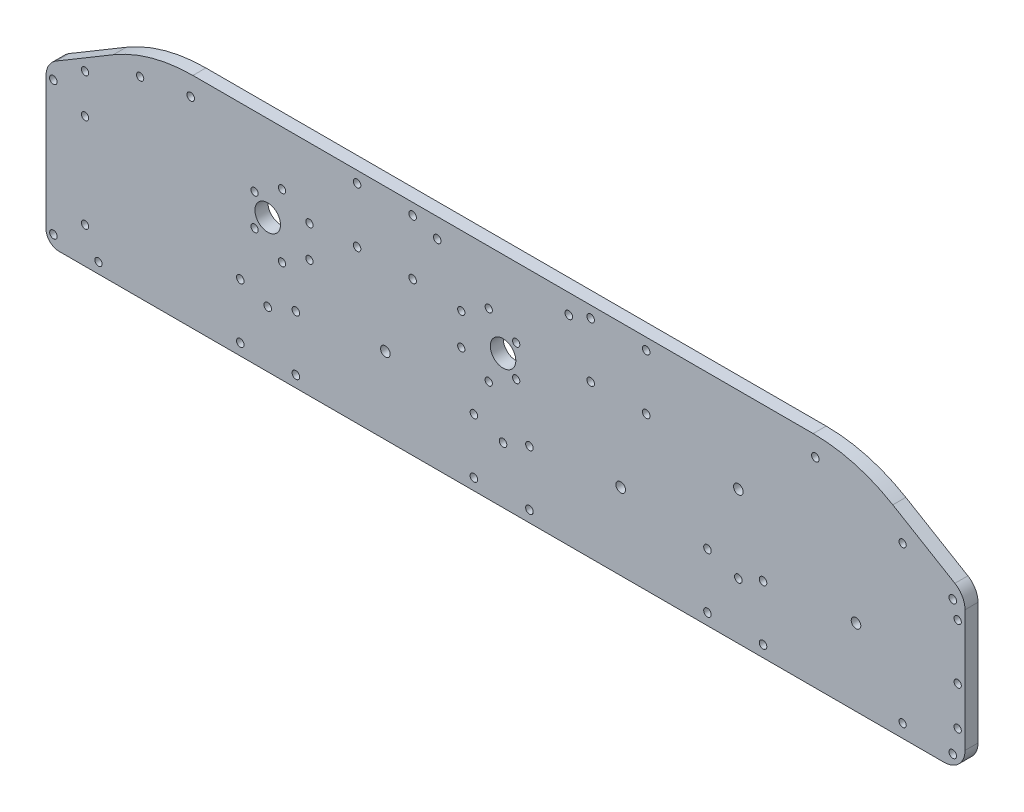
from build123d import *

# Parameters (mm, degrees)
SKETCH1_R           = 2.35
SKETCH1_R_2         = 6.25
SKETCH1_R_3         = 2.349999999
SKETCH1_R_4         = 1.778
SKETCH1_R_5         = 1.85000011
SKETCH1_R_6         = 1.85
BOSS_EXTRUDE3_DEPTH = 6.35


with BuildPart() as part:
    # Sketch1 → Boss-Extrude3 (new body)
    with BuildSketch(Plane.XY):
        with BuildLine():
            Line((226.06, 0), (226.06, -27.287756374))
            ThreePointArc((226.06, -27.287756374), (223.084204897, -34.471961271), (215.9, -37.447756374))
            Line((215.9, -37.447756374), (-215.9, -37.447756374))
            Line((-215.9, -37.447756374), (-217.287383527, -37.447756374))
            ThreePointArc((-217.287383527, -37.447756374), (-221.777511587, -35.587884434), (-223.637383527, -31.097756374))
            Line((-223.637383527, -31.097756374), (-223.637383527, 33.765977424))
            ThreePointArc((-223.637383527, 33.765977424), (-222.309818874, 38.787300541), (-218.674059542, 42.49639313))
            Line((-218.674059542, 42.49639313), (-190.732762109, 59.128117792))
            ThreePointArc((-190.732762109, 59.128117792), (-171.969166759, 67.120649159), (-151.757691995, 69.85))
            Line((-151.757691995, 69.85), (151.757691995, 69.85))
            ThreePointArc((151.757691995, 69.85), (171.969166759, 67.120649159), (190.732762109, 59.128117792))
            Line((190.732762109, 59.128117792), (221.096676015, 41.054359515))
            ThreePointArc((221.096676015, 41.054359515), (224.732435347, 37.345266926), (226.06, 32.323943809))
            Line((226.06, 32.323943809), (226.06, 0))
        make_face()
        with Locations((-57.57418, 0)):
            Circle(SKETCH1_R, mode=Mode.SUBTRACT)
        with Locations((57.5724782, 0)):
            Circle(SKETCH1_R, mode=Mode.SUBTRACT)
        with Locations((172.72, 0)):
            Circle(SKETCH1_R, mode=Mode.SUBTRACT)
        with Locations((-115.14709, 27.952818)):
            Circle(SKETCH1_R_2, mode=Mode.SUBTRACT)
        with Locations((-0.0008509, 27.951954786)):
            Circle(SKETCH1_R_2, mode=Mode.SUBTRACT)
        with Locations((115.1462391, 27.951065379)):
            Circle(SKETCH1_R_3, mode=Mode.SUBTRACT)
        with Locations((-108.14709, 43.452818)):
            Circle(SKETCH1_R_4, mode=Mode.SUBTRACT)
        with Locations((-94.723696241, 35.702818)):
            Circle(SKETCH1_R_4, mode=Mode.SUBTRACT)
        with Locations((-94.723696241, 20.202818)):
            Circle(SKETCH1_R_4, mode=Mode.SUBTRACT)
        with Locations((-108.14709, 12.452818)):
            Circle(SKETCH1_R_4, mode=Mode.SUBTRACT)
        with Locations((-121.570483759, 20.202818)):
            Circle(SKETCH1_R_4, mode=Mode.SUBTRACT)
        with Locations((-121.570483759, 35.702818)):
            Circle(SKETCH1_R_4, mode=Mode.SUBTRACT)
        with Locations((-7.0008509, 43.451954786)):
            Circle(SKETCH1_R_4, mode=Mode.SUBTRACT)
        with Locations((6.422542859, 35.701954786)):
            Circle(SKETCH1_R_4, mode=Mode.SUBTRACT)
        with Locations((6.422542859, 20.201954786)):
            Circle(SKETCH1_R_4, mode=Mode.SUBTRACT)
        with Locations((-7.0008509, 12.451954786)):
            Circle(SKETCH1_R_4, mode=Mode.SUBTRACT)
        with Locations((-20.424244659, 20.201954786)):
            Circle(SKETCH1_R_4, mode=Mode.SUBTRACT)
        with Locations((-20.424244659, 35.701954786)):
            Circle(SKETCH1_R_4, mode=Mode.SUBTRACT)
        with Locations((-71.417984205, 64.270384182)):
            Circle(SKETCH1_R_5, mode=Mode.SUBTRACT)
        with Locations((-32.17418, 60.325)):
            Circle(SKETCH1_R_6, mode=Mode.SUBTRACT)
        with Locations((-152.82418, 60.325)):
            Circle(SKETCH1_R_6, mode=Mode.SUBTRACT)
        with Locations((152.82418, 60.325)):
            Circle(SKETCH1_R_6, mode=Mode.SUBTRACT)
        with Locations((32.17418, 60.325)):
            Circle(SKETCH1_R_6, mode=Mode.SUBTRACT)
        with Locations((-44.232364205, 64.270384182)):
            Circle(SKETCH1_R_5, mode=Mode.SUBTRACT)
        with Locations((115.1453882, -9.897181959)):
            Circle(SKETCH1_R_6, mode=Mode.SUBTRACT)
        with Locations((-115.14709, -9.897181959)):
            Circle(SKETCH1_R_6, mode=Mode.SUBTRACT)
        with Locations((-0.00127, -9.897181959)):
            Circle(SKETCH1_R_6, mode=Mode.SUBTRACT)
        with Locations((220.058830169, 33.81345012)):
            Circle(SKETCH1_R_6, mode=Mode.SUBTRACT)
        with Locations((-220.058830169, 33.81345012)):
            Circle(SKETCH1_R_6, mode=Mode.SUBTRACT)
        with Locations((220.058830169, -31.752755237)):
            Circle(SKETCH1_R_5, mode=Mode.SUBTRACT)
        with Locations((-220.000076831, -31.65099147)):
            Circle(SKETCH1_R_5, mode=Mode.SUBTRACT)
        with Locations((-71.417984205, 37.329615818)):
            Circle(SKETCH1_R_5, mode=Mode.SUBTRACT)
        with Locations((-44.232364205, 37.329615818)):
            Circle(SKETCH1_R_5, mode=Mode.SUBTRACT)
        with Locations((42.882015795, 64.270384182)):
            Circle(SKETCH1_R_5, mode=Mode.SUBTRACT)
        with Locations((70.067635795, 64.270384182)):
            Circle(SKETCH1_R_5, mode=Mode.SUBTRACT)
        with Locations((42.882015795, 37.329615818)):
            Circle(SKETCH1_R_5, mode=Mode.SUBTRACT)
        with Locations((70.067635795, 37.329615818)):
            Circle(SKETCH1_R_5, mode=Mode.SUBTRACT)
        with Locations((-128.567984205, -4.927372192)):
            Circle(SKETCH1_R_5, mode=Mode.SUBTRACT)
        with Locations((-101.382364205, -4.927372192)):
            Circle(SKETCH1_R_5, mode=Mode.SUBTRACT)
        with Locations((-101.382364205, -31.868140555)):
            Circle(SKETCH1_R_5, mode=Mode.SUBTRACT)
        with Locations((-128.567984205, -31.868140555)):
            Circle(SKETCH1_R_5, mode=Mode.SUBTRACT)
        with Locations((-14.267984205, -4.927372192)):
            Circle(SKETCH1_R_5, mode=Mode.SUBTRACT)
        with Locations((12.917635795, -4.927372192)):
            Circle(SKETCH1_R_5, mode=Mode.SUBTRACT)
        with Locations((12.917635795, -31.868140555)):
            Circle(SKETCH1_R_5, mode=Mode.SUBTRACT)
        with Locations((-14.267984205, -31.868140555)):
            Circle(SKETCH1_R_5, mode=Mode.SUBTRACT)
        with Locations((100.032015795, -4.927372192)):
            Circle(SKETCH1_R_5, mode=Mode.SUBTRACT)
        with Locations((127.217635795, -4.927372192)):
            Circle(SKETCH1_R_5, mode=Mode.SUBTRACT)
        with Locations((127.217635795, -31.868140555)):
            Circle(SKETCH1_R_5, mode=Mode.SUBTRACT)
        with Locations((100.032015795, -31.868140555)):
            Circle(SKETCH1_R_5, mode=Mode.SUBTRACT)
        with Locations((195.527631613, 45.220384182)):
            Circle(SKETCH1_R_4, mode=Mode.SUBTRACT)
        with Locations((222.468399976, 26.170384182)):
            Circle(SKETCH1_R_4, mode=Mode.SUBTRACT)
        with Locations((222.468399976, -19.820384182)):
            Circle(SKETCH1_R_4, mode=Mode.SUBTRACT)
        with Locations((195.527631613, -30.979615818)):
            Circle(SKETCH1_R_4, mode=Mode.SUBTRACT)
        with Locations((222.468399976, -0.770384182)):
            Circle(SKETCH1_R_4, mode=Mode.SUBTRACT)
        with Locations((-177.581600024, 56.379615818)):
            Circle(SKETCH1_R_4, mode=Mode.SUBTRACT)
        with Locations((-204.522368387, 45.220384182)):
            Circle(SKETCH1_R_4, mode=Mode.SUBTRACT)
        with Locations((-197.966781419, -32.314797213)):
            Circle(SKETCH1_R_4, mode=Mode.SUBTRACT)
        with Locations((-204.522368387, -19.820384182)):
            Circle(SKETCH1_R_4, mode=Mode.SUBTRACT)
        with Locations((-204.522368387, 26.170384182)):
            Circle(SKETCH1_R_4, mode=Mode.SUBTRACT)
    extrude(amount=BOSS_EXTRUDE3_DEPTH)


solid = part.part
